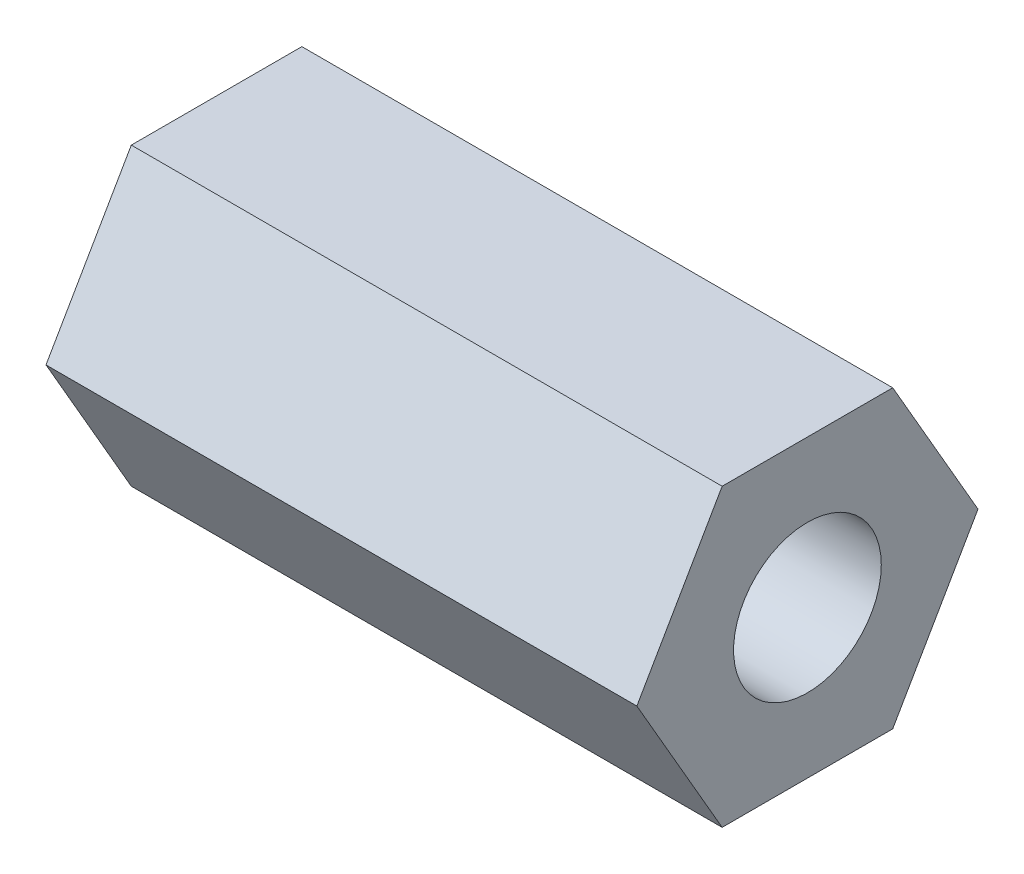
from build123d import *

# Parameters (mm, degrees)
SKETCH1_R           = 1.25
BOSS_EXTRUDE2_DEPTH = 10


with BuildPart() as part:
    # Sketch1 → Boss-Extrude2 (new body)
    with BuildSketch(Plane(origin=(0, 0, 0), x_dir=(0, 0, -1), z_dir=(1, 0, 0))):
        Polygon((2.886751346, 0), (1.443375673, 2.5), (-1.443375673, 2.5), (-2.886751346, 0), (-1.443375673, -2.5), (1.443375673, -2.5), align=None)
        Circle(SKETCH1_R, mode=Mode.SUBTRACT)
    extrude(amount=BOSS_EXTRUDE2_DEPTH)


solid = part.part
